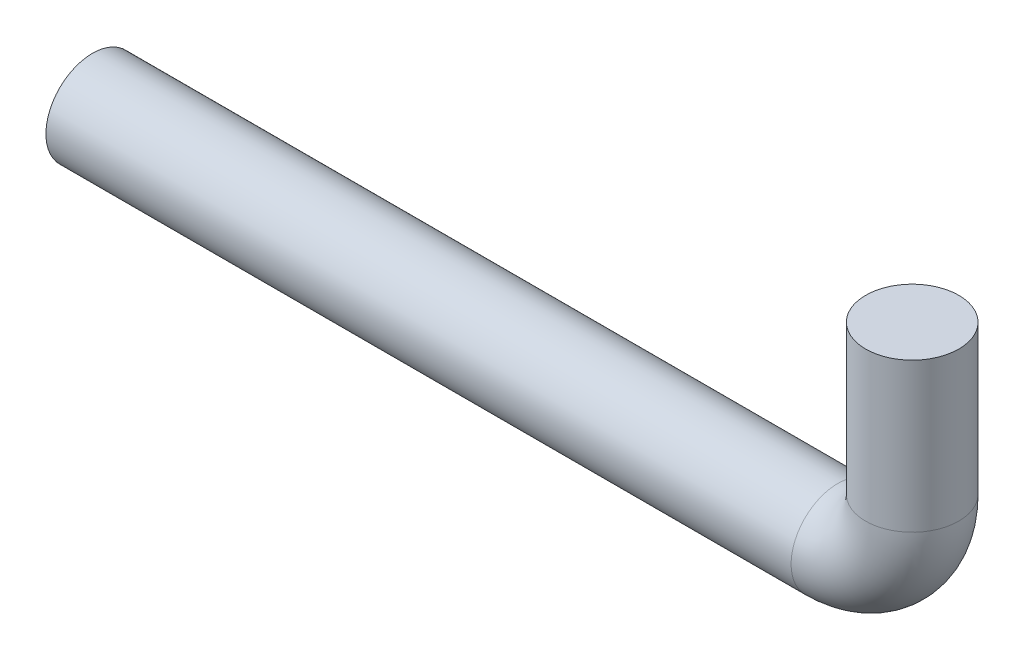
from build123d import *

# Parameters (mm, degrees)
SKETCH1_R = 0.79375


with BuildPart() as part:
    # Sweep1: sweep along a path in Sketch2
    with BuildLine(Plane.XY) as sweep1_path:
        Line((0, 0), (12.7, 0))
        ThreePointArc((12.7, 0), (13.598025612, 0.371974388), (13.97, 1.27))
        Line((13.97, 1.27), (13.97, 3.81))
    # Sketch1 → Sweep1 (sweep)
    with BuildSketch(Plane(origin=(0, 0, 0), x_dir=(0, 0, -1), z_dir=(1, 0, 0))):
        Circle(SKETCH1_R)
    sweep(path=sweep1_path.line)


solid = part.part
